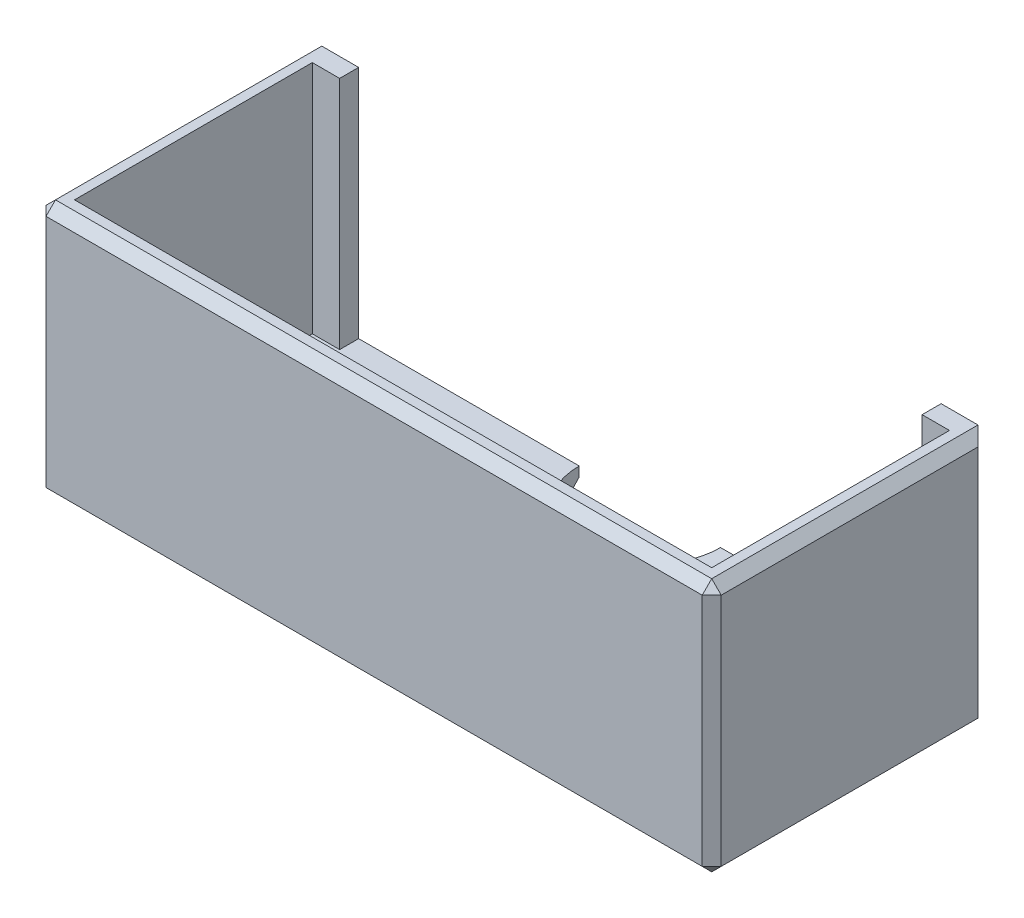
from build123d import *

# Parameters (mm, degrees)
SKETCH1_W               = 71
SKETCH1_H               = 29
SKETCH1_W_2             = 67
SKETCH1_H_2             = 25
EXTRUDE_THIN1_DEPTH     = 24.7
CUT_EXTRUDE1_DEPTH      = 46.613484848
CUT_EXTRUDE1_DEPTH_BACK = 46.613484848
SKETCH2_W               = 61.246689818
SKETCH2_H               = 16.669960146
BOSS_EXTRUDE1_DEPTH     = 2
CHAMFER1_SIZE           = 1


with BuildPart() as part:
    # Sketch1 → Extrude-Thin1 (new body)
    with BuildSketch(Plane(origin=(0, 0, 0), x_dir=(1, 0, 0), z_dir=(0, 1, 0))):
        Rectangle(SKETCH1_W, SKETCH1_H)
        Rectangle(SKETCH1_W_2, SKETCH1_H_2, mode=Mode.SUBTRACT)
    extrude(amount=-EXTRUDE_THIN1_DEPTH)

    # Sketch2 → Cut-Extrude1 (cut, two sides: drawn at the far end of the back side and taken through both)
    with BuildSketch(Plane(origin=(0, 0, 0), x_dir=(1, 0, 0), z_dir=(0, 1, 0)).offset(-CUT_EXTRUDE1_DEPTH_BACK)):
        with Locations((0, 12.5)):
            Rectangle(SKETCH2_W, SKETCH2_H)
    extrude(amount=CUT_EXTRUDE1_DEPTH + CUT_EXTRUDE1_DEPTH_BACK, mode=Mode.SUBTRACT)

    # Sketch3 → Boss-Extrude1 (add)
    with BuildSketch(Plane.XZ.offset(24.7)):
        with BuildLine():
            Line((7.43, -14.5), (30.623344909, -14.5))
            Line((30.623344909, -14.5), (30.623344909, -12.5))
            Line((30.623344909, -12.5), (33.5, -12.5))
            Line((33.5, -12.5), (33.5, 12.5))
            Line((33.5, 12.5), (-33.5, 12.5))
            Line((-33.5, 12.5), (-33.5, -12.5))
            Line((-33.5, -12.5), (-30.623344909, -12.5))
            Line((-30.623344909, -12.5), (-30.623344909, -14.5))
            Line((-30.623344909, -14.5), (-7.43, -14.5))
            ThreePointArc((-7.43, -14.5), (0, -7.07), (7.43, -14.5))
        make_face()
        Polygon((33.5, 12.5), (33.5, -12.5), (30.623344909, -12.5), (30.623344909, -14.5), (35.5, -14.5), (35.5, 14.5), (-35.5, 14.5), (-35.5, -14.5), (-30.623344909, -14.5), (-30.623344909, -12.5), (-33.5, -12.5), (-33.5, 12.5), align=None)
    extrude(amount=BOSS_EXTRUDE1_DEPTH)

    # Chamfer1
    chamfer1_edges = [part.edges().sort_by_distance(p)[0] for p in [
        (0, 0, 14.5),
        (-35.5, 0, 0),
        (35.5, 0, 0),
        (21.465, -26.7, -14.5),
        (35.5, -26.7, 0),
        (0, -26.7, 14.5),
        (-35.5, -26.7, 0),
        (-21.465, -26.7, -14.5),
        (35.5, -13.35, 14.5),
        (-35.5, -13.35, 14.5),
        (-35.5, -13.35, -14.5),
        (35.5, -13.35, -14.5),
    ]]
    chamfer(chamfer1_edges, length=CHAMFER1_SIZE)


solid = part.part
